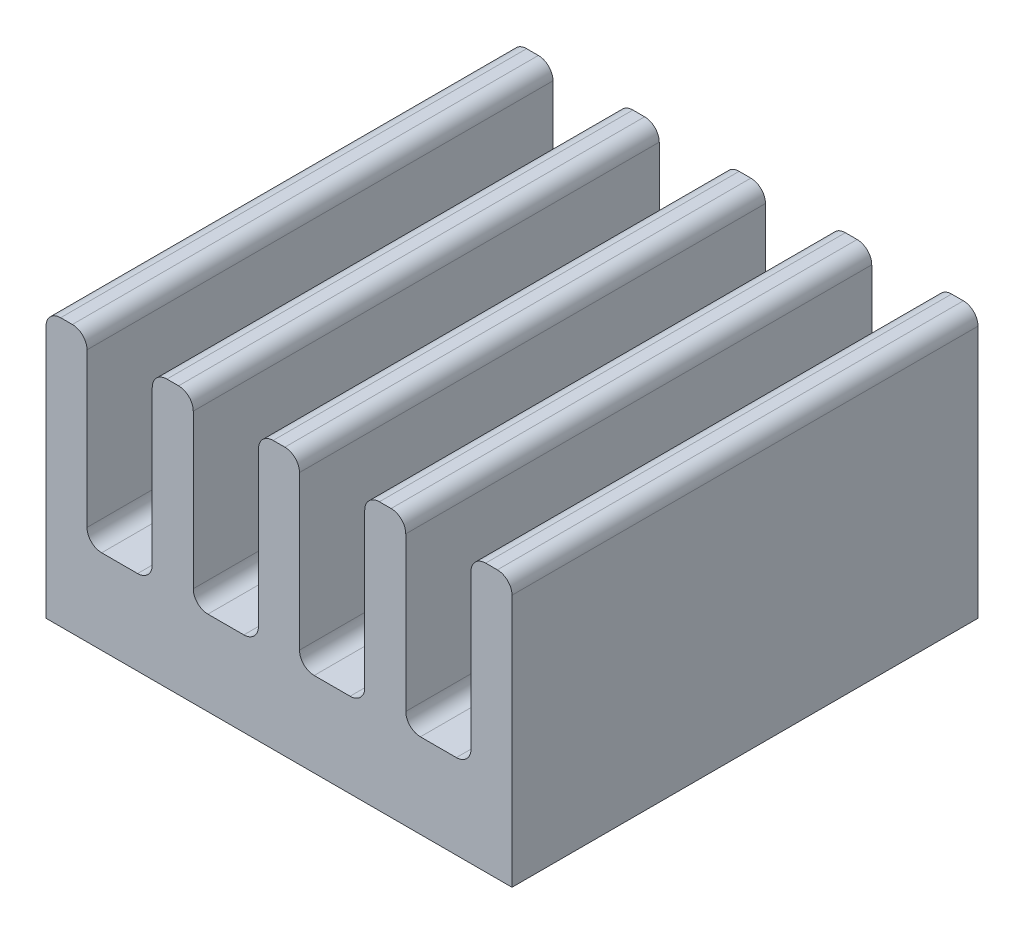
from build123d import *

# Parameters (mm, degrees)
BOSS_EXTRUDE1_START = -1.6129
SKETCH2_W           = 8.89
SKETCH2_H           = 8.89
BOSS_EXTRUDE1_DEPTH = 5.1054
SKETCH3_W           = 1.2446
SKETCH3_H           = 8.89
CUT_EXTRUDE1_DEPTH  = 8.1912173
FILLET1_R           = 0.2794


with BuildPart() as part:
    # Sketch2 → Boss-Extrude1 (new body)
    with BuildSketch(Plane(origin=(0, 0, 0), x_dir=(1, 0, 0), z_dir=(0, 1, 0)).offset(BOSS_EXTRUDE1_START)):
        Rectangle(SKETCH2_W, SKETCH2_H)
    extrude(amount=BOSS_EXTRUDE1_DEPTH)

    # Sketch3 → Cut-Extrude1 (cut, through all)
    with BuildSketch(Plane(origin=(0, 0, 0), x_dir=(1, 0, 0), z_dir=(0, 1, 0))):
        with Locations((-3.04038, 0)):
            Rectangle(SKETCH3_W, SKETCH3_H)
        with Locations((-1.01346, 0)):
            Rectangle(SKETCH3_W, SKETCH3_H)
        with Locations((1.01346, 0)):
            Rectangle(SKETCH3_W, SKETCH3_H)
        with Locations((3.04038, 0)):
            Rectangle(SKETCH3_W, SKETCH3_H)
    extrude(amount=CUT_EXTRUDE1_DEPTH, mode=Mode.SUBTRACT)

    # Fillet1
    fillet1_edges = [part.edges().sort_by_distance(p)[0] for p in [
        (-4.445, 3.4925, 0),
        (-2.41808, 3.4925, 0),
        (-3.66268, 0, 0),
        (-3.66268, 3.4925, 0),
        (-2.41808, 0, 0),
        (4.445, 3.4925, 0),
        (-1.63576, 0, 0),
        (-0.39116, 3.4925, 0),
        (-1.63576, 3.4925, 0),
        (-0.39116, 0, 0),
        (0.39116, 0, 0),
        (1.63576, 3.4925, 0),
        (0.39116, 3.4925, 0),
        (1.63576, 0, 0),
        (2.41808, 0, 0),
        (3.66268, 3.4925, 0),
        (2.41808, 3.4925, 0),
        (3.66268, 0, 0),
    ]]
    fillet(fillet1_edges, radius=FILLET1_R)


solid = part.part
